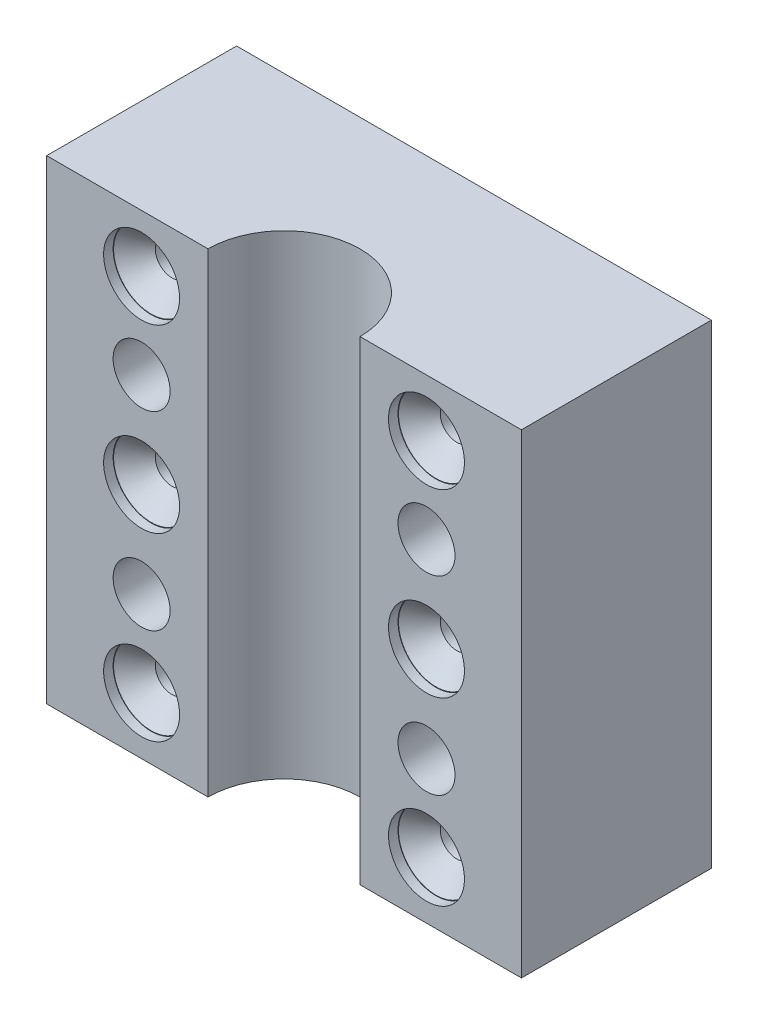
from build123d import *

# Parameters (mm, degrees)
SKETCH1_W           = 50
SKETCH1_H           = 50
BOSS_EXTRUDE1_DEPTH = 20
SKETCH2_R           = 8
CUT_EXTRUDE1_DEPTH  = 67.942210384
SKETCH3_R           = 3
CUT_EXTRUDE2_DEPTH  = 43
CUT_EXTRUDE5_DEPTH  = 5
SKETCH7_R           = 1.75
CUT_EXTRUDE6_DEPTH  = 41
SKETCH9_R           = 4
CUT_EXTRUDE7_DEPTH  = 1
CHAMFER1_SIZE       = 2.2


with BuildPart() as part:
    # Sketch1 → Boss-Extrude1 (new body)
    with BuildSketch(Plane.XY):
        with Locations((25, 25)):
            Rectangle(SKETCH1_W, SKETCH1_H)
    extrude(amount=BOSS_EXTRUDE1_DEPTH)

    # Sketch2 → Cut-Extrude1 (cut)
    with BuildSketch(Plane(origin=(0, 50, 0), x_dir=(1, 0, 0), z_dir=(0, 1, 0))):
        with Locations((25, -20)):
            Circle(SKETCH2_R)
    extrude(amount=-CUT_EXTRUDE1_DEPTH, mode=Mode.SUBTRACT)

    # Sketch3 → Cut-Extrude2 (cut)
    with BuildSketch(Plane.XY.offset(20)):
        with Locations((10, 35)):
            Circle(SKETCH3_R)
        with Locations((10, 15)):
            Circle(SKETCH3_R)
        with Locations((40, 35)):
            Circle(SKETCH3_R)
        with Locations((40, 15)):
            Circle(SKETCH3_R)
    extrude(amount=-CUT_EXTRUDE2_DEPTH, mode=Mode.SUBTRACT)

    # Sketch6 → Cut-Extrude5 (cut)
    with BuildSketch(Plane(origin=(0, 0, 0), x_dir=(-1, 0, 0), z_dir=(0, 0, -1))):
        Polygon((-3.937822174, 15), (-6.968911087, 20.25), (-13.031088913, 20.25), (-16.062177826, 15), (-13.031088913, 9.75), (-6.968911087, 9.75), align=None)
        Polygon((-43.031088913, 20.25), (-46.062177826, 15), (-43.031088913, 9.75), (-36.968911087, 9.75), (-33.937822174, 15), (-36.968911087, 20.25), align=None)
        Polygon((-36.968911087, 29.75), (-33.937822174, 35), (-36.968911087, 40.25), (-43.031088913, 40.25), (-46.062177826, 35), (-43.031088913, 29.75), align=None)
        Polygon((-6.968911087, 29.75), (-3.937822174, 35), (-6.968911087, 40.25), (-13.031088913, 40.25), (-16.062177826, 35), (-13.031088913, 29.75), align=None)
    extrude(amount=-CUT_EXTRUDE5_DEPTH, mode=Mode.SUBTRACT)

    # Sketch7 → Cut-Extrude6 (cut)
    with BuildSketch(Plane.XY.offset(20)):
        with Locations((10, 6)):
            Circle(SKETCH7_R)
        with Locations((10, 25)):
            Circle(SKETCH7_R)
        with Locations((10, 44)):
            Circle(SKETCH7_R)
        with Locations((40, 44)):
            Circle(SKETCH7_R)
        with Locations((40, 25)):
            Circle(SKETCH7_R)
        with Locations((40, 6)):
            Circle(SKETCH7_R)
    extrude(amount=-CUT_EXTRUDE6_DEPTH, mode=Mode.SUBTRACT)

    # Sketch9 → Cut-Extrude7 (cut)
    with BuildSketch(Plane.XY.offset(20)):
        with Locations((10, 44)):
            Circle(SKETCH9_R)
        with Locations((10, 25)):
            Circle(SKETCH9_R)
        with Locations((10, 6)):
            Circle(SKETCH9_R)
        with Locations((40, 6)):
            Circle(SKETCH9_R)
        with Locations((40, 25)):
            Circle(SKETCH9_R)
        with Locations((40, 44)):
            Circle(SKETCH9_R)
    extrude(amount=-CUT_EXTRUDE7_DEPTH, mode=Mode.SUBTRACT)

    # Chamfer1
    chamfer1_edges = [part.edges().sort_by_distance(p)[0] for p in [
        (8.25, 44, 19),
        (8.25, 25, 19),
        (8.25, 6, 19),
        (38.25, 6, 19),
        (38.25, 25, 19),
        (38.25, 44, 19),
    ]]
    chamfer(chamfer1_edges, length=CHAMFER1_SIZE)


solid = part.part
